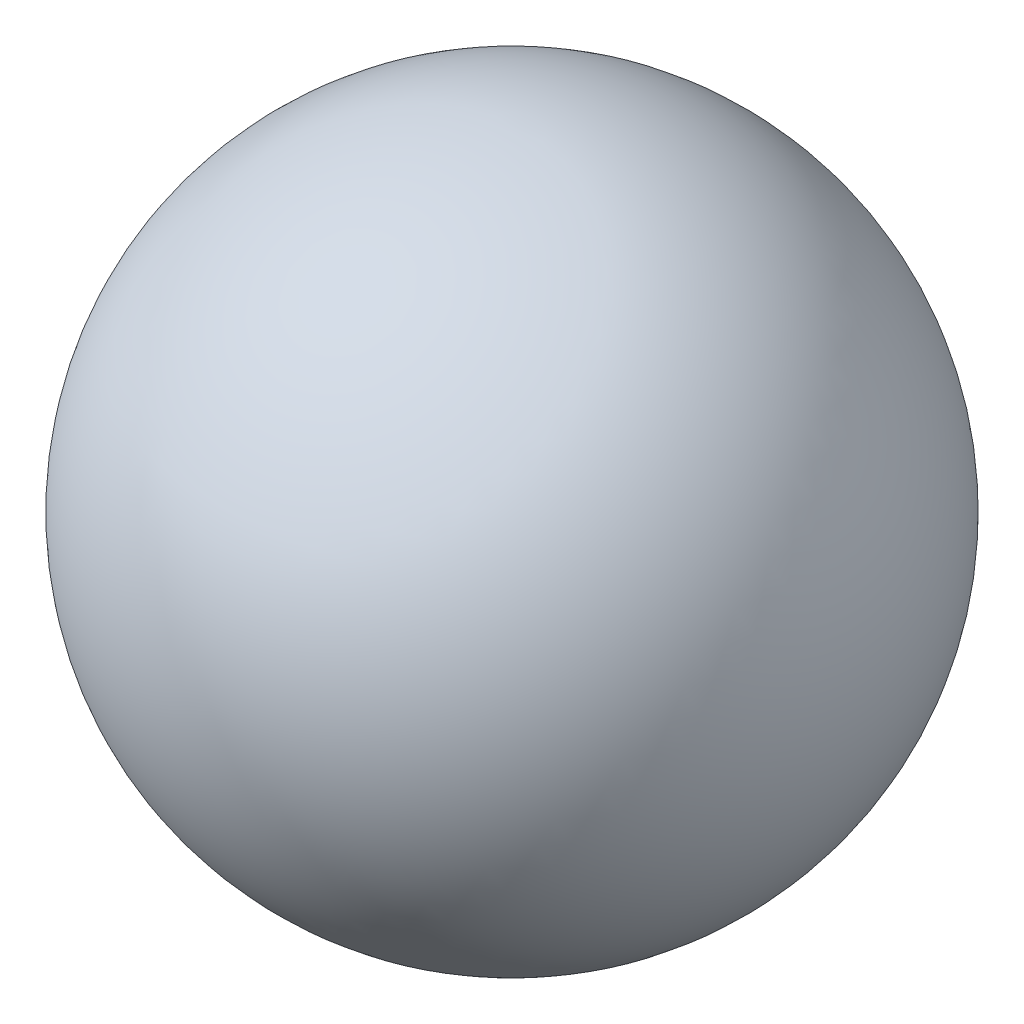
from build123d import *


with BuildPart() as part:
    # Sketch1 → Revolve5 (revolve)
    with BuildSketch(Plane.XY):
        with BuildLine():
            Line((0, 40.759333193), (0, 36.115188227))
            ThreePointArc((0, 36.115188227), (36.115188227, 0), (0, -36.115188227))
            Line((0, -36.115188227), (0, -40.759333193))
            ThreePointArc((0, -40.759333193), (40.759333193, 0), (0, 40.759333193))
        make_face()
    revolve(axis=Axis((0, 0, 0), (0, 1, 0)))


solid = part.part
